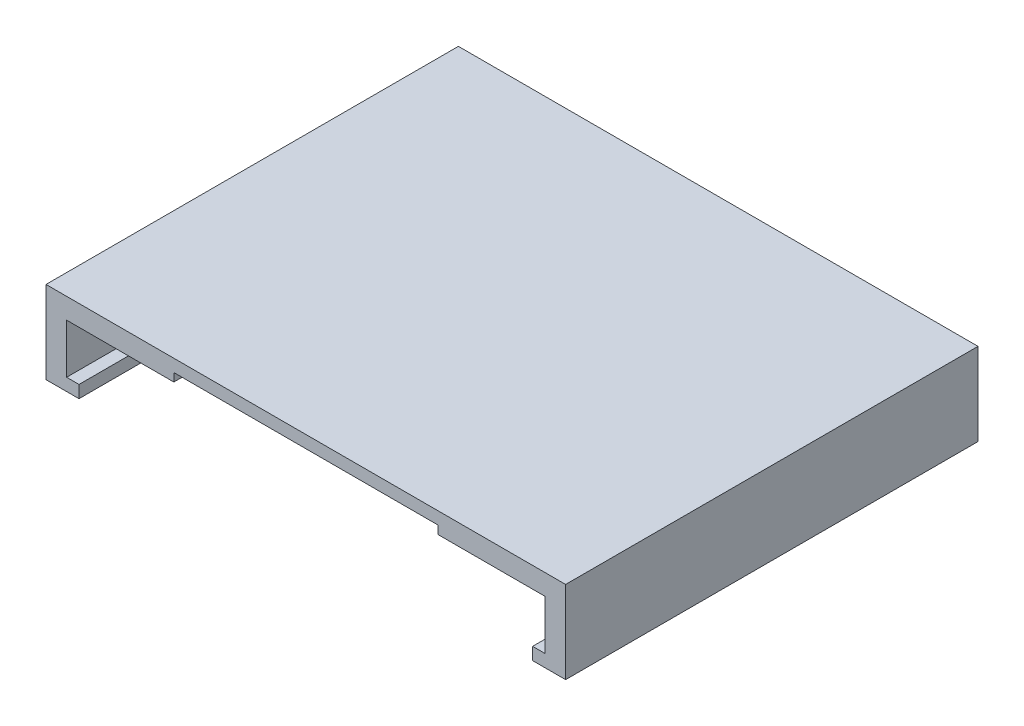
from build123d import *

# Parameters (mm, degrees)
EXTRUDE_1_DEPTH = 50


with BuildPart() as part:
    # 스케치1 → 보스-돌출1 (new body)
    with BuildSketch(Plane.XY):
        Polygon((0, 1.5), (0, 0), (4, 0), (4, 1.5), (2.5, 1.5), (2.5, 7.5), (15.5, 7.5), (15.5, 8.5), (47.5, 8.5), (47.5, 7.5), (60.5, 7.5), (60.5, 1.5), (59, 1.5), (59, 0), (63, 0), (63, 3.5), (63, 10), (0, 10), align=None)
    extrude(amount=EXTRUDE_1_DEPTH)


solid = part.part
